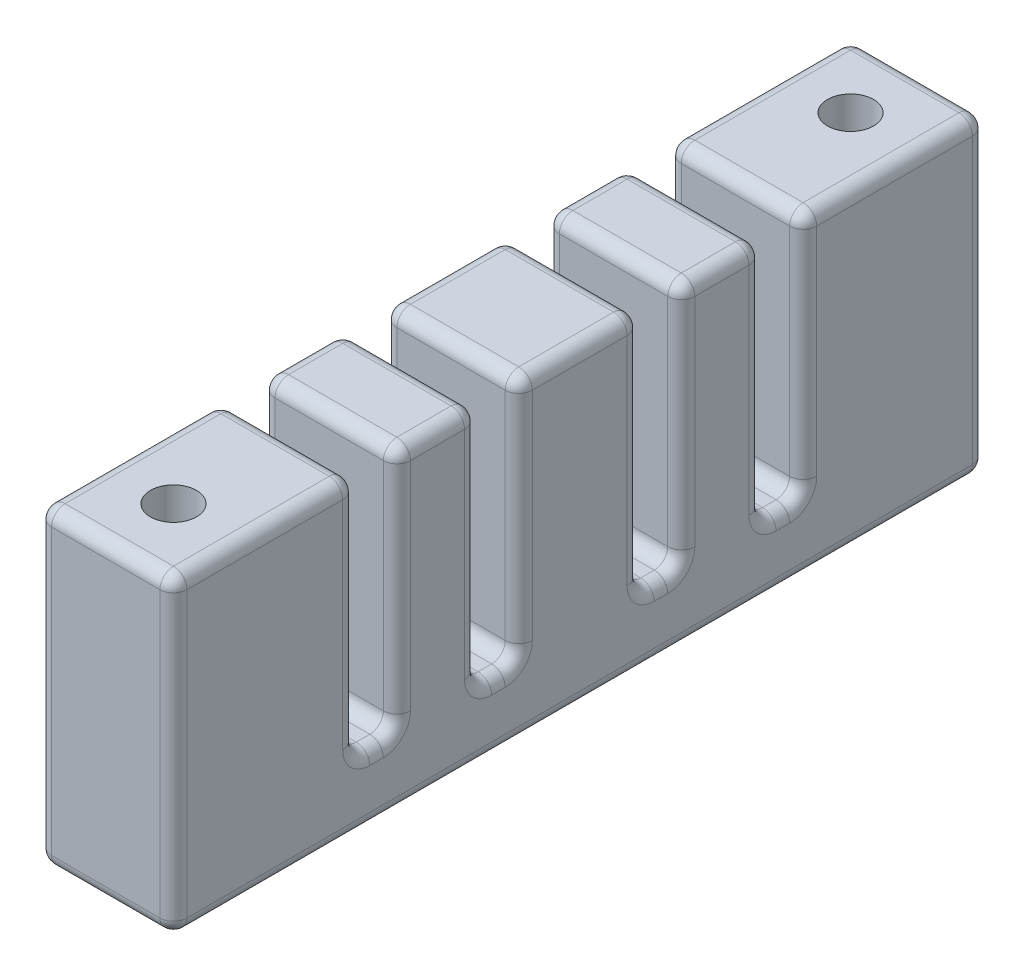
from build123d import *

# Parameters (mm, degrees)
SKETCH1_W           = 10
SKETCH1_H           = 60
SKETCH1_R           = 1.7
BOSS_EXTRUDE1_DEPTH = 5
SKETCH2_W           = 10
SKETCH2_H           = 6
SKETCH2_H_2         = 9
SKETCH2_H_3         = 13.5
SKETCH2_R           = 1.7
BOSS_EXTRUDE2_DEPTH = 18
FILLET1_R           = 1


with BuildPart() as part:
    # Sketch1 → Boss-Extrude1 (new body)
    with BuildSketch(Plane(origin=(0, 0, 0), x_dir=(1, 0, 0), z_dir=(0, 1, 0))):
        Rectangle(SKETCH1_W, SKETCH1_H)
        with Locations(Location((0, 25, 0), (0, 0, 270))):
            Circle(SKETCH1_R, mode=Mode.SUBTRACT)
        with Locations(Location((0, -25, 0), (0, 0, 270))):
            Circle(SKETCH1_R, mode=Mode.SUBTRACT)
    extrude(amount=BOSS_EXTRUDE1_DEPTH)

    # Sketch2 → Boss-Extrude2 (add)
    # profile 1 of 5: a face of its own
    with BuildSketch(Plane(origin=(0, 5, 0), x_dir=(1, 0, 0), z_dir=(0, 1, 0))):
        with Locations((0, 10.5)):
            Rectangle(SKETCH2_W, SKETCH2_H)
    # profile 2 of 5: a face of its own
    with BuildSketch(Plane(origin=(0, 5, 0), x_dir=(1, 0, 0), z_dir=(0, 1, 0))):
        Rectangle(SKETCH2_W, SKETCH2_H_2)
    # profile 3 of 5: a face of its own
    with BuildSketch(Plane(origin=(0, 5, 0), x_dir=(1, 0, 0), z_dir=(0, 1, 0))):
        with Locations((0, 23.25)):
            Rectangle(SKETCH2_W, SKETCH2_H_3)
        with Locations(Location((0, 25, 0), (0, 0, 270))):
            Circle(SKETCH2_R, mode=Mode.SUBTRACT)
    # profile 4 of 5: a face of its own
    with BuildSketch(Plane(origin=(0, 5, 0), x_dir=(1, 0, 0), z_dir=(0, 1, 0))):
        with Locations((0, -23.25)):
            Rectangle(SKETCH2_W, SKETCH2_H_3)
        with Locations(Location((0, -25, 0), (0, 0, 270))):
            Circle(SKETCH2_R, mode=Mode.SUBTRACT)
    # profile 5 of 5: a face of its own
    with BuildSketch(Plane(origin=(0, 5, 0), x_dir=(1, 0, 0), z_dir=(0, 1, 0))):
        with Locations((0, -10.5)):
            Rectangle(SKETCH2_W, SKETCH2_H)
    extrude(amount=BOSS_EXTRUDE2_DEPTH)

    # Fillet1
    fillet1_edges = [part.edges().sort_by_distance(p)[0] for p in [
        (-5, 5, 6),
        (5, 5, -6),
        (5, 14, 4.5),
        (0, 5, -4.5),
        (5, 14, -4.5),
        (-5, 14, -4.5),
        (0, 5, 4.5),
        (-5, 14, 4.5),
        (5, 23, 0),
        (0, 23, -4.5),
        (-5, 23, 0),
        (0, 23, 4.5),
        (-5, 5, -15),
        (-5, 23, -23.25),
        (0, 23, -16.5),
        (5, 23, -23.25),
        (0, 23, -30),
        (0, 5, -16.5),
        (-5, 14, -16.5),
        (5, 14, -16.5),
        (5, 5, -15),
        (-5, 5, -6),
        (0, 5, -7.5),
        (0, 0, -30),
        (-5, 14, -7.5),
        (5, 14, -7.5),
        (0, 5, -13.5),
        (5, 14, -13.5),
        (-5, 14, -13.5),
        (0, 23, -7.5),
        (5, 23, -10.5),
        (0, 23, -13.5),
        (-5, 23, -10.5),
        (5, 0, 0),
        (0, 0, 30),
        (5, 5, 15),
        (5, 23, 23.25),
        (0, 23, 16.5),
        (-5, 23, 23.25),
        (0, 23, 30),
        (0, 5, 16.5),
        (-5, 0, 0),
        (5, 14, 16.5),
        (-5, 14, 16.5),
        (5, 5, 6),
        (-5, 5, 15),
        (-5, 14, 7.5),
        (0, 5, 13.5),
        (-5, 14, 13.5),
        (5, 14, 13.5),
        (0, 5, 7.5),
        (5, 14, 7.5),
        (-5, 23, 10.5),
        (0, 23, 13.5),
        (5, 23, 10.5),
        (0, 23, 7.5),
        (-5, 11.5, -30),
        (5, 11.5, -30),
        (5, 11.5, 30),
        (-5, 11.5, 30),
    ]]
    fillet(fillet1_edges, radius=FILLET1_R)


solid = part.part
